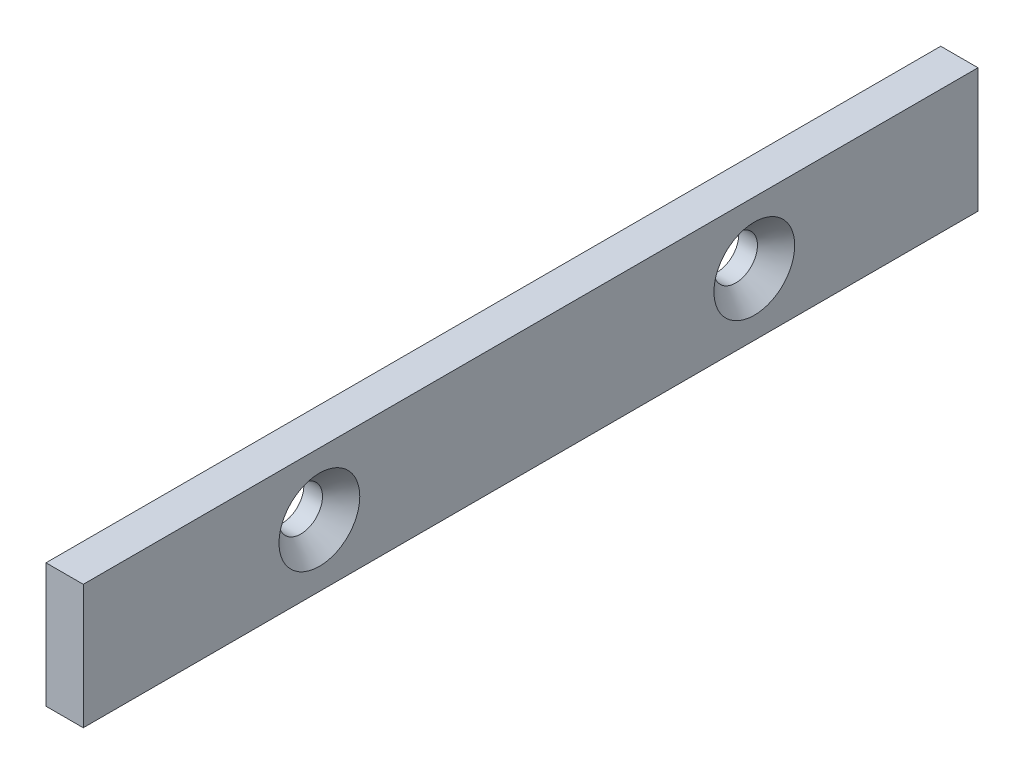
from build123d import *

# Parameters (mm, degrees)
SKETCH1_W           = 144
SKETCH1_H           = 20
SKETCH1_R           = 3.5
BOSS_EXTRUDE1_DEPTH = 6
CHAMFER1_SIZE       = 3


with BuildPart() as part:
    # Sketch1 → Boss-Extrude1 (new body)
    with BuildSketch(Plane(origin=(0, 0, 0), x_dir=(0, 0, -1), z_dir=(1, 0, 0))):
        Rectangle(SKETCH1_W, SKETCH1_H)
        with Locations((-34, 0)):
            Circle(SKETCH1_R, mode=Mode.SUBTRACT)
        with Locations((36, 0)):
            Circle(SKETCH1_R, mode=Mode.SUBTRACT)
    extrude(amount=-BOSS_EXTRUDE1_DEPTH)

    # Chamfer1
    chamfer1_edges = [part.edges().sort_by_distance(p)[0] for p in [
        (0, 0, 37.5),
        (0, 0, -32.5),
    ]]
    chamfer(chamfer1_edges, length=CHAMFER1_SIZE)


solid = part.part
